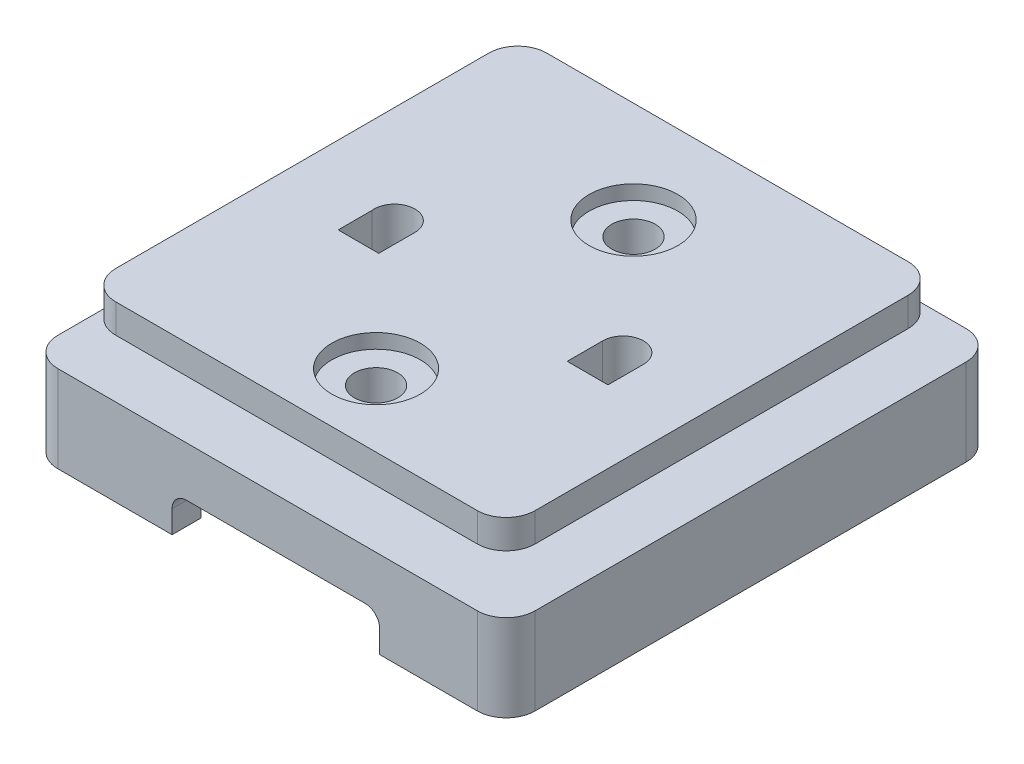
from build123d import *

# Parameters (mm, degrees)
BOSS_EXTRUDE3_DEPTH     = 6
SHELL2_T                = -2
CUT_EXTRUDE4_DEPTH      = 32
CUT_EXTRUDE4_DEPTH_BACK = 34.275216002
SKETCH2_R               = 1.5
SKETCH2_R_2             = 1.407616296
SKETCH2_R_3             = 1.41
SKETCH2_W               = 1.407616296
SKETCH2_H               = 2.445621179
SKETCH2_W_2             = 1.376750608
SKETCH7_R               = 2.502744699
SKETCH7_R_2             = 1.5
BOSS_EXTRUDE4_DEPTH     = 6
SKETCH8_R               = 2.53531283
SKETCH8_R_2             = 1.518842354
BOSS_EXTRUDE6_DEPTH     = 4
FILLET1_R               = 2
FILLET2_R               = 2
CUT_EXTRUDE6_REACH      = 40.307
SKETCH10_W              = 14.351477832
SKETCH10_H              = 5
FILLET3_R               = 1
SKETCH11_R              = 3.20834654
SKETCH11_R_2            = 3.35149953
CUT_EXTRUDE7_DEPTH      = 0.4
SKETCH14_W              = 23
SKETCH14_H              = 23.8
BOSS_EXTRUDE9_DEPTH     = 2
BOSS_EXTRUDE10_DEPTH    = 2
SKETCH16_R              = 1.5
SKETCH16_R_2            = 1.407616296
SKETCH16_R_3            = 1.41
SKETCH16_W              = 2.806264375
SKETCH16_H              = 2.502132393
SKETCH16_W_2            = 2.82
SKETCH16_H_2            = 2.45355852
CUT_EXTRUDE9_DEPTH      = 33.299225997
SKETCH17_R              = 3.066424979
SKETCH17_R_2            = 3.059739342
CUT_EXTRUDE10_DEPTH     = 1


with BuildPart() as part:
    # Sketch1 → Boss-Extrude3 (new body)
    with BuildSketch(Plane(origin=(0, 0, 0), x_dir=(1, 0, 0), z_dir=(0, 1, 0))):
        Polygon((0, -7), (-17, -7), (-17, 17.8), (-17, 26.8), (16, 26.8), (16, 17.8), (16, -7), align=None)
    extrude(amount=BOSS_EXTRUDE3_DEPTH)

    # Shell2
    shell2_openings = [part.faces().sort_by_distance(p)[0] for p in [
        (-0.5, 0, -9.9),
    ]]
    offset(amount=SHELL2_T, openings=shell2_openings, kind=Kind.INTERSECTION)

    # Sketch2 → Cut-Extrude4 (cut, two sides: drawn at the far end of the back side and taken through both)
    with BuildSketch(Plane(origin=(0, 10, 0), x_dir=(1, 0, 0), z_dir=(0, 1, 0)).offset(-CUT_EXTRUDE4_DEPTH_BACK)):
        with Locations(Location((0, 17.8, 0), (0, 0, 270))):
            Circle(SKETCH2_R)
        with Locations((-8.22, 9.5)):
            Circle(SKETCH2_R_2)
        with Locations((7.58, 9.5)):
            Circle(SKETCH2_R_3)
        with Locations(Location((0, 0, 0), (0, 0, 270))):
            Circle(SKETCH2_R)
        with Locations((-7.516191852, 8.277189411)):
            Rectangle(SKETCH2_W, SKETCH2_H)
        with Locations((6.891624696, 8.277189411)):
            Rectangle(SKETCH2_W_2, SKETCH2_H)
    extrude(amount=CUT_EXTRUDE4_DEPTH + CUT_EXTRUDE4_DEPTH_BACK, mode=Mode.SUBTRACT)

    # Sketch7 → Boss-Extrude4 (add)
    with BuildSketch(Plane(origin=(0, 6, 0), x_dir=(1, 0, 0), z_dir=(0, 1, 0))):
        with Locations(Location((0, 17.8, 0), (0, 0, 270))):
            Circle(SKETCH7_R)
        with Locations(Location((0, 17.8, 0), (0, 0, 270))):
            Circle(SKETCH7_R_2, mode=Mode.SUBTRACT)
    extrude(amount=-BOSS_EXTRUDE4_DEPTH)

    # Sketch8 → Boss-Extrude6 (add)
    with BuildSketch(Plane.XZ.offset(-4)):
        with Locations(Location((0, 0, 0), (0, 0, 90))):
            Circle(SKETCH8_R)
        with Locations(Location((0, 0, 0), (0, 0, 90))):
            Circle(SKETCH8_R_2, mode=Mode.SUBTRACT)
    extrude(amount=BOSS_EXTRUDE6_DEPTH)

    # Fillet1
    fillet1_edges = [part.edges().sort_by_distance(p)[0] for p in [
        (-17, 3, 7),
        (-17, 3, -26.8),
        (16, 3, -26.8),
        (16, 3, 7),
    ]]
    fillet(fillet1_edges, radius=FILLET1_R)

    # Fillet2
    fillet2_edges = [part.edges().sort_by_distance(p)[0] for p in [
        (14, 2, 5),
        (14, 2, -24.8),
        (-15, 2, -24.8),
        (-15, 2, 5),
    ]]
    fillet(fillet2_edges, radius=FILLET2_R)

    # Sketch10 → Cut-Extrude6 (cut, up to next)
    with BuildSketch(Plane.XY.offset(7), mode=Mode.PRIVATE) as cut_extrude6_sk1:
        with Locations((0.071944839, 0.064631552)):
            Rectangle(SKETCH10_W, SKETCH10_H)
    cut_extrude6_tool1 = extrude(cut_extrude6_sk1.sketch, amount=-CUT_EXTRUDE6_REACH, mode=Mode.PRIVATE) & part.part
    add(cut_extrude6_tool1.solids().sort_by_distance((0.071945, 0.064632, 7))[0], mode=Mode.SUBTRACT)

    # Fillet3
    fillet3_edges = [part.edges().sort_by_distance(p)[0] for p in [
        (7.247683755, 2.564631552, 6),
        (-7.103794077, 2.564631552, 6),
    ]]
    fillet(fillet3_edges, radius=FILLET3_R)

    # Sketch11 → Cut-Extrude7 (cut)
    with BuildSketch(Plane.XZ):
        Circle(SKETCH11_R)
        with Locations((0, -17.8)):
            Circle(SKETCH11_R_2)
    extrude(amount=-CUT_EXTRUDE7_DEPTH, mode=Mode.SUBTRACT)

    # Sketch14 → Boss-Extrude9 (add)
    with BuildSketch(Plane(origin=(0, 6, 0), x_dir=(1, 0, 0), z_dir=(0, 1, 0))):
        with Locations((-0.5, 9.9)):
            Rectangle(SKETCH14_W, SKETCH14_H)
    extrude(amount=BOSS_EXTRUDE9_DEPTH)

    # Sketch15 → Boss-Extrude10 (add)
    with BuildSketch(Plane(origin=(0, 8, 0), x_dir=(1, 0, 0), z_dir=(0, 1, 0))):
        with BuildLine():
            Line((14, -3), (14, 22.8))
            ThreePointArc((14, 22.8), (13.414213562, 24.214213562), (12, 24.8))
            Line((12, 24.8), (-13, 24.8))
            ThreePointArc((-13, 24.8), (-14.414213562, 24.214213562), (-15, 22.8))
            Line((-15, 22.8), (-15, -3))
            ThreePointArc((-15, -3), (-14.414213562, -4.414213562), (-13, -5))
            Line((-13, -5), (12, -5))
            ThreePointArc((12, -5), (13.414213562, -4.414213562), (14, -3))
        make_face()
    extrude(amount=BOSS_EXTRUDE10_DEPTH)

    # Sketch16 → Cut-Extrude9 (cut, through all)
    with BuildSketch(Plane.XZ.offset(-4)):
        with Locations(Location((0, 0, 0), (0, 0, 270))):
            Circle(SKETCH16_R)
        with Locations(Location((0, -17.8, 0), (0, 0, 270))):
            Circle(SKETCH16_R)
        with Locations((-8.22, -9.5)):
            Circle(SKETCH16_R_2)
        with Locations((7.58, -9.5)):
            Circle(SKETCH16_R_3)
        with Locations((-8.215515892, -8.248933803)):
            Rectangle(SKETCH16_W, SKETCH16_H)
        with Locations((7.58, -8.27322074)):
            Rectangle(SKETCH16_W_2, SKETCH16_H_2)
    extrude(amount=-CUT_EXTRUDE9_DEPTH, mode=Mode.SUBTRACT)

    # Sketch17 → Cut-Extrude10 (cut)
    with BuildSketch(Plane(origin=(0, 10, 0), x_dir=(1, 0, 0), z_dir=(0, 1, 0))):
        with Locations(Location((0, 17.8, 0), (0, 0, 270))):
            Circle(SKETCH17_R)
        with Locations(Location((0, 0, 0), (0, 0, 270))):
            Circle(SKETCH17_R_2)
    extrude(amount=-CUT_EXTRUDE10_DEPTH, mode=Mode.SUBTRACT)


solid = part.part
